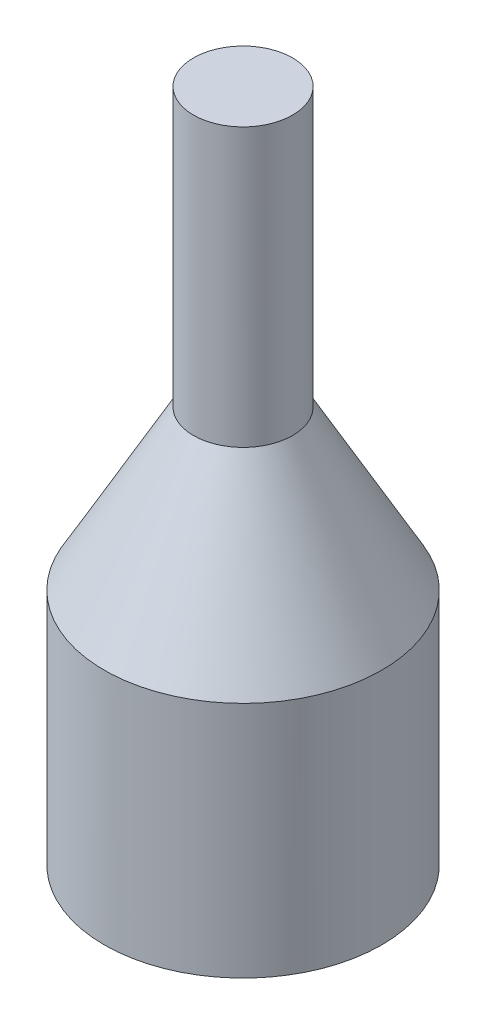
from build123d import *

# Parameters (mm, degrees)
SKETCH1_R           = 7
BOSS_EXTRUDE1_DEPTH = 12
SKETCH3_R           = 2.5
SKETCH4_R           = 7
SKETCH5_R           = 2.5
BOSS_EXTRUDE2_DEPTH = 14
SKETCH6_R           = 4
CUT_EXTRUDE1_DEPTH  = 14


with BuildPart() as part:
    # Sketch1 → Boss-Extrude1 (new body)
    with BuildSketch(Plane(origin=(0, 0, 0), x_dir=(1, 0, 0), z_dir=(0, 1, 0))):
        with Locations(Location((0, 0, 0), (0, 0, 270))):
            Circle(SKETCH1_R)
    extrude(amount=BOSS_EXTRUDE1_DEPTH)

    # Sketch3 → Loft1 section 0
    with BuildSketch(Plane(origin=(0, 20, 0), x_dir=(1, 0, 0), z_dir=(0, 1, 0))):
        Circle(SKETCH3_R)
    # Sketch4 → Loft1 section 1
    with BuildSketch(Plane(origin=(0, 12, 0), x_dir=(1, 0, 0), z_dir=(0, 1, 0))):
        Circle(SKETCH4_R)
    loft()

    # Sketch5 → Boss-Extrude2 (add)
    with BuildSketch(Plane(origin=(0, 20, 0), x_dir=(1, 0, 0), z_dir=(0, 1, 0))):
        with Locations(Location((0, 0, 0), (0, 0, 270))):
            Circle(SKETCH5_R)
    extrude(amount=BOSS_EXTRUDE2_DEPTH)

    # Sketch6 → Cut-Extrude1 (cut)
    with BuildSketch(Plane.XZ):
        with Locations(Location((0, 0, 0), (0, 0, 270))):
            Circle(SKETCH6_R)
    extrude(amount=-CUT_EXTRUDE1_DEPTH, mode=Mode.SUBTRACT)


solid = part.part
